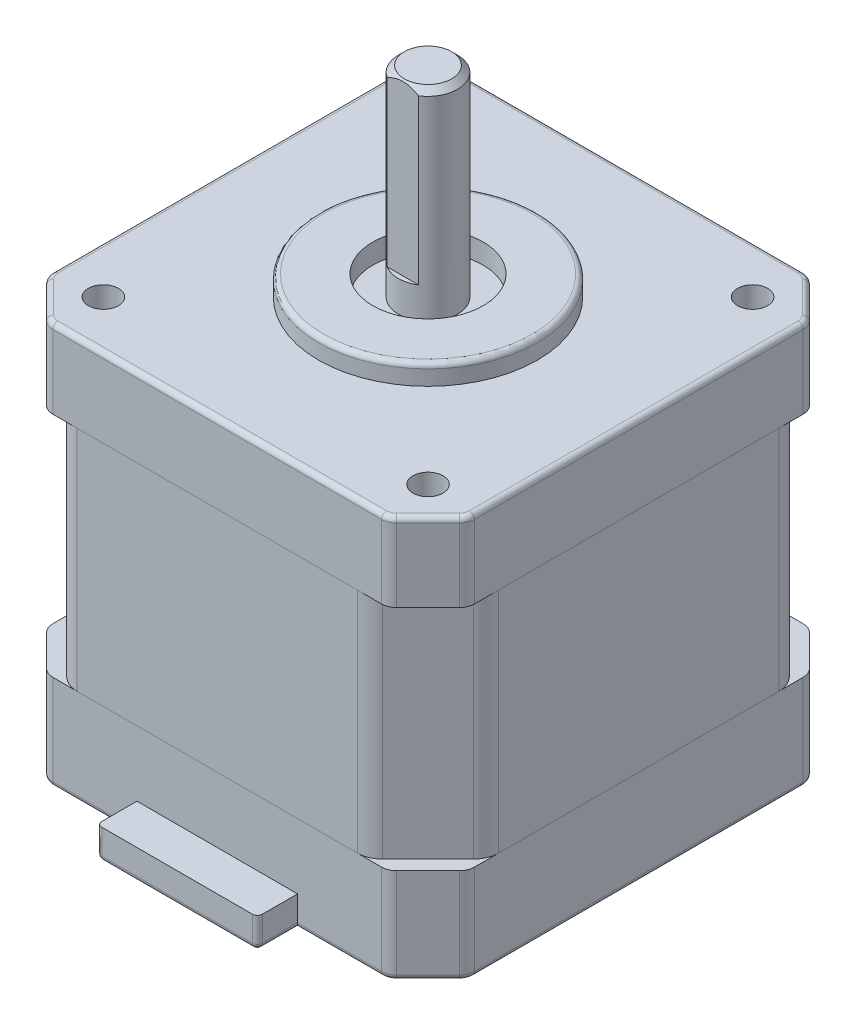
from build123d import *

# Parameters (mm, degrees)
SKETCH1_W           = 42
SKETCH1_H           = 42
BOSS_EXTRUDE1_DEPTH = 40
SKETCH3_R           = 10.9
SKETCH3_R_2         = 5.5
BOSS_EXTRUDE2_DEPTH = 2
SKETCH4_R           = 2.95
BOSS_EXTRUDE3_DEPTH = 20
CHAMFER1_SIZE       = 6
CHAMFER2_SIZE       = 4
CHAMFER3_SIZE       = 4
FILLET1_R           = 2.5
FILLET2_R           = 1.5
FILLET3_R           = 1.5
CHAMFER4_SIZE       = 0.6
SKETCH5_W           = 16
SKETCH5_H           = 3
BOSS_EXTRUDE4_DEPTH = 4
SKETCH6_R           = 4.5
CUT_EXTRUDE1_DEPTH  = 4
SKETCH7_R           = 1.5
CUT_EXTRUDE2_DEPTH  = 7.5
FILLET4_R           = 0.5
FILLET5_R           = 0.5
FILLET6_R           = 0.5
SKETCH8_W           = 18.208712608
SKETCH8_H           = 35.420928506
CUT_EXTRUDE4_DEPTH  = 6


with BuildPart() as part:
    # Sketch1 → Boss-Extrude1 (new body)
    with BuildSketch(Plane(origin=(0, 0, 0), x_dir=(1, 0, 0), z_dir=(0, 1, 0))):
        Rectangle(SKETCH1_W, SKETCH1_H)
    extrude(amount=BOSS_EXTRUDE1_DEPTH)

    # Sketch3 → Boss-Extrude2 (add)
    with BuildSketch(Plane(origin=(0, 40, 0), x_dir=(1, 0, 0), z_dir=(0, 1, 0))):
        with Locations(Location((0, 0, 0), (0, 0, 270))):
            Circle(SKETCH3_R)
        with Locations(Location((0, 0, 0), (0, 0, 270))):
            Circle(SKETCH3_R_2, mode=Mode.SUBTRACT)
    extrude(amount=BOSS_EXTRUDE2_DEPTH)

    # Sketch4 → Boss-Extrude3 (add)
    with BuildSketch(Plane(origin=(0, 40, 0), x_dir=(1, 0, 0), z_dir=(0, 1, 0))):
        with Locations(Location((0, 0, 0), (0, 0, 270))):
            Circle(SKETCH4_R)
    extrude(amount=BOSS_EXTRUDE3_DEPTH)


with BuildPart() as body_2:
    # Split1: the piece on the far side of the plane
    add(part.part)
    split(bisect_by=Plane(origin=(0, 9.5, 0), x_dir=(0, 0, -1), z_dir=(0, -1, 0)), keep=Keep.BOTTOM)


with BuildPart() as part_1:
    add(part.part)

    # Split1
    split(bisect_by=Plane(origin=(0, 9.5, 0), x_dir=(0, 0, -1), z_dir=(0, -1, 0)), keep=Keep.TOP)

    # Chamfer3
    chamfer3_edges = [part_1.edges().sort_by_distance(p)[0] for p in [
        (21, 4.75, 21),
        (-21, 4.75, 21),
        (-21, 4.75, -21),
        (21, 4.75, -21),
    ]]
    chamfer(chamfer3_edges, length=CHAMFER3_SIZE)

    # Fillet2
    fillet2_edges = [part_1.edges().sort_by_distance(p)[0] for p in [
        (-17, 4.75, -21),
        (17, 4.75, -21),
        (21, 4.75, 17),
        (21, 4.75, -17),
        (-17, 4.75, 21),
        (17, 4.75, 21),
        (-21, 4.75, -17),
        (-21, 4.75, 17),
    ]]
    fillet(fillet2_edges, radius=FILLET2_R)

    # Sketch5 → Boss-Extrude4 (add)
    with BuildSketch(Plane.XY.offset(21)):
        with Locations((0, 1.5)):
            Rectangle(SKETCH5_W, SKETCH5_H)
    extrude(amount=BOSS_EXTRUDE4_DEPTH)

    # Sketch6 → Cut-Extrude1 (cut)
    with BuildSketch(Plane.XZ):
        with Locations(Location((0, 0, 0), (0, 0, 270))):
            Circle(SKETCH6_R)
    extrude(amount=-CUT_EXTRUDE1_DEPTH, mode=Mode.SUBTRACT)

    # Fillet6
    fillet6_edges = [part_1.edges().sort_by_distance(p)[0] for p in [
        (12.189339828, 0, 21),
        (-8, 0, 23),
        (8, 0, 23),
        (-8, 1.5, 25),
        (0, 0, 25),
        (8, 1.5, 25),
        (0, 0, 4.5),
        (0, 0, -21),
        (19, 0, -19),
        (21, 0, 0),
        (19, 0, 19),
        (-12.189339828, 0, 21),
        (-19, 0, 19),
        (-21, 0, 0),
        (-19, 0, -19),
        (-20.885819299, 0, -16.952704805),
        (-16.952704805, 0, -20.885819299),
        (-20.885819299, 0, 16.952704805),
        (-16.952704805, 0, 20.885819299),
        (16.952704805, 0, 20.885819299),
        (20.885819299, 0, 16.952704805),
        (20.885819299, 0, -16.952704805),
        (16.952704805, 0, -20.885819299),
    ]]
    fillet(fillet6_edges, radius=FILLET6_R)


with BuildPart() as body_3:
    # Split2: the piece on the far side of the plane
    add(body_2.part)
    split(bisect_by=Plane.ZX.offset(32.2), keep=Keep.BOTTOM)

    # Chamfer1
    chamfer1_edges = [body_3.edges().sort_by_distance(p)[0] for p in [
        (21, 20.85, -21),
        (-21, 20.85, -21),
        (-21, 20.85, 21),
        (21, 20.85, 21),
    ]]
    chamfer(chamfer1_edges, length=CHAMFER1_SIZE)

    # Fillet1
    fillet1_edges = [body_3.edges().sort_by_distance(p)[0] for p in [
        (15, 20.85, 21),
        (-15, 20.85, 21),
        (-21, 20.85, -15),
        (-21, 20.85, 15),
        (15, 20.85, -21),
        (-15, 20.85, -21),
        (21, 20.85, 15),
        (21, 20.85, -15),
    ]]
    fillet(fillet1_edges, radius=FILLET1_R)


with BuildPart() as body_2_1:
    add(body_2.part)

    # Split2
    split(bisect_by=Plane.ZX.offset(32.2), keep=Keep.TOP)

    # Chamfer2
    chamfer2_edges = [body_2_1.edges().sort_by_distance(p)[0] for p in [
        (21, 36.1, 21),
        (-21, 36.1, 21),
        (-21, 36.1, -21),
        (21, 36.1, -21),
    ]]
    chamfer(chamfer2_edges, length=CHAMFER2_SIZE)

    # Fillet3
    fillet3_edges = [body_2_1.edges().sort_by_distance(p)[0] for p in [
        (21, 36.1, -17),
        (21, 36.1, 17),
        (-17, 36.1, 21),
        (17, 36.1, 21),
        (-21, 36.1, -17),
        (-21, 36.1, 17),
        (17, 36.1, -21),
        (-17, 36.1, -21),
    ]]
    fillet(fillet3_edges, radius=FILLET3_R)

    # Chamfer4
    chamfer4_edges = [body_2_1.edges().sort_by_distance(p)[0] for p in [
        (0, 60, -2.95),
    ]]
    chamfer(chamfer4_edges, length=CHAMFER4_SIZE)

    # Sketch7 → Cut-Extrude2 (cut)
    with BuildSketch(Plane(origin=(0, 40, 0), x_dir=(1, 0, 0), z_dir=(0, 1, 0))):
        with Locations(Location((-16.171572875, 16.171572875, 0), (0, 0, 270))):
            Circle(SKETCH7_R)
        with Locations(Location((16.171572875, 16.171572875, 0), (0, 0, 270))):
            Circle(SKETCH7_R)
        with Locations(Location((16.171572875, -16.171572875, 0), (0, 0, 270))):
            Circle(SKETCH7_R)
        with Locations(Location((-16.171572875, -16.171572875, 0), (0, 0, 270))):
            Circle(SKETCH7_R)
    extrude(amount=-CUT_EXTRUDE2_DEPTH, mode=Mode.SUBTRACT)

    # Fillet4
    fillet4_edges = [body_2_1.edges().sort_by_distance(p)[0] for p in [
        (0, 40, -21),
        (0, 40, 21),
        (19, 40, 19),
        (21, 40, 0),
        (19, 40, -19),
        (-19, 40, -19),
        (-21, 40, 0),
        (-19, 40, 19),
        (-20.885819299, 40, -16.952704805),
        (-20.885819299, 40, 16.952704805),
        (-16.952704805, 40, 20.885819299),
        (16.952704805, 40, 20.885819299),
        (20.885819299, 40, 16.952704805),
        (20.885819299, 40, -16.952704805),
        (16.952704805, 40, -20.885819299),
        (-16.952704805, 40, -20.885819299),
    ]]
    fillet(fillet4_edges, radius=FILLET4_R)

    # Fillet5
    fillet5_edges = [body_2_1.edges().sort_by_distance(p)[0] for p in [
        (0, 42, -10.9),
    ]]
    fillet(fillet5_edges, radius=FILLET5_R)

    # Sketch8 → Cut-Extrude4 (cut)
    with BuildSketch(Plane.XY.offset(2.5)):
        with Locations((-4.810823062, 60.781172609)):
            Rectangle(SKETCH8_W, SKETCH8_H)
    extrude(amount=CUT_EXTRUDE4_DEPTH, mode=Mode.SUBTRACT)


solid = Compound([part_1.part, body_3.part, body_2_1.part])
